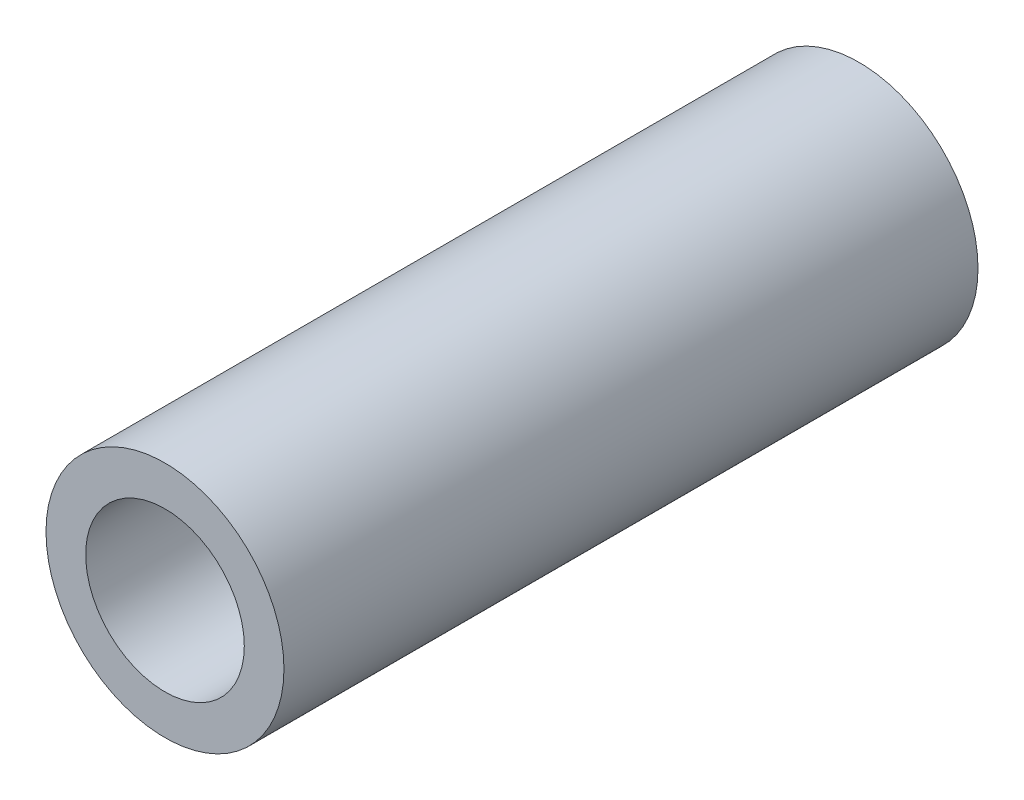
from build123d import *

# Parameters (mm, degrees)
SKETCH1_R           = 6
SKETCH1_R_2         = 4
BOSS_EXTRUDE1_DEPTH = 33
BOSS_EXTRUDE2_START = -2
SKETCH1_2_R         = 6
BOSS_EXTRUDE2_DEPTH = 2


with BuildPart() as part:
    # Sketch1 → Boss-Extrude1 (new body)
    with BuildSketch(Plane.XY):
        Circle(SKETCH1_R)
        Circle(SKETCH1_R_2, mode=Mode.SUBTRACT)
    extrude(amount=BOSS_EXTRUDE1_DEPTH)

    # Sketch1<2> → Boss-Extrude2 (add)
    with BuildSketch(Plane.XY.offset(BOSS_EXTRUDE2_START)):
        Circle(SKETCH1_2_R)
    extrude(amount=BOSS_EXTRUDE2_DEPTH)


solid = part.part
